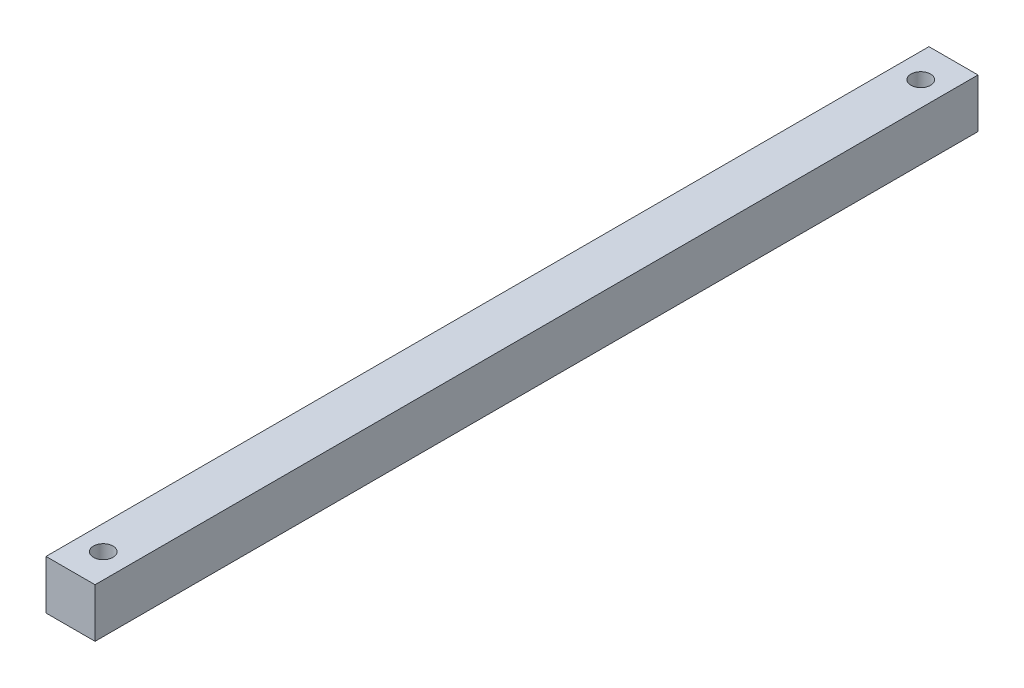
from build123d import *

# Parameters (mm, degrees)
SKETCH_1_W          = 15
SKETCH_1_H          = 15
EXTRUDE_1_DEPTH     = 270
SKETCH_2_R          = 3
CUT_EXTRUDE_1_DEPTH = 271.832051279


with BuildPart() as part:
    # 草图1 → 凸台-拉伸1 (new body)
    with BuildSketch(Plane.XY):
        with Locations((7.5, -7.5)):
            Rectangle(SKETCH_1_W, SKETCH_1_H)
    extrude(amount=EXTRUDE_1_DEPTH)

    # 草图2 → 切除-拉伸1 (cut, through all)
    with BuildSketch(Plane(origin=(0, 0, 0), x_dir=(1, 0, 0), z_dir=(0, 1, 0))):
        with Locations(Location((7.5, -10, 0), (0, 0, 270))):
            Circle(SKETCH_2_R)
        with Locations(Location((7.5, -260, 0), (0, 0, 270))):
            Circle(SKETCH_2_R)
    extrude(amount=-CUT_EXTRUDE_1_DEPTH, mode=Mode.SUBTRACT)


solid = part.part
